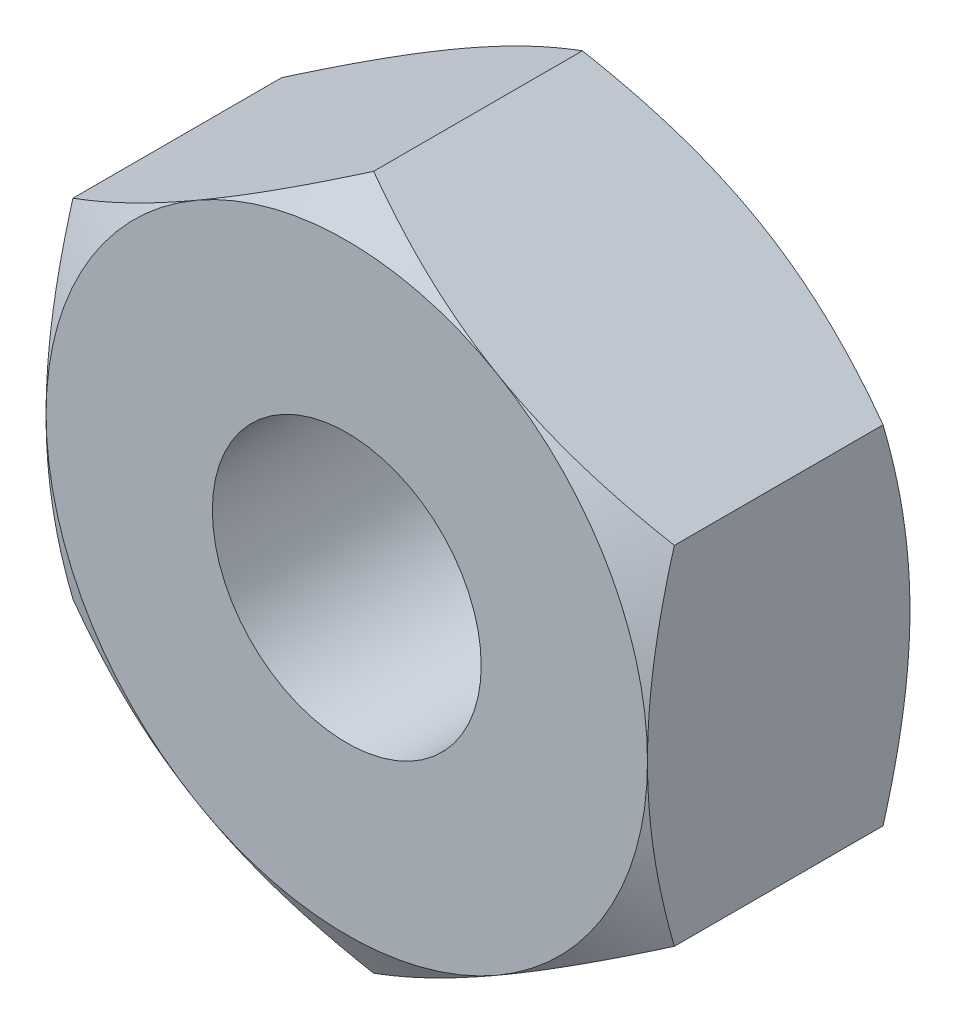
from build123d import *

# Parameters (mm, degrees)
SKETCH_1_R          = 1.229375
EXTRUDE_597_DEPTH   = 2.4
SKETCH_2_OUTSIDE_W  = 29.47
SKETCH_2_OUTSIDE_H  = 30.32
SKETCH_2_OUTSIDE_R  = 2.75
CUT_EXTRUDE_1_DEPTH = 5.837957558
CUT_EXTRUDE_1_DRAFT = -60
SKETCH_3_OUTSIDE_W  = 29.47
SKETCH_3_OUTSIDE_H  = 30.32
SKETCH_3_OUTSIDE_R  = 2.75
CUT_EXTRUDE_2_DEPTH = 5.837957558
CUT_EXTRUDE_2_DRAFT = -60


with BuildPart() as part:
    # 草图1 → Extrude 597 (new body)
    with BuildSketch(Plane.XY):
        Polygon((0, 3.175426481), (-2.75, 1.58771324), (-2.75, -1.58771324), (0, -3.175426481), (2.75, -1.58771324), (2.75, 1.58771324), align=None)
        Circle(SKETCH_1_R, mode=Mode.SUBTRACT)
    extrude(amount=EXTRUDE_597_DEPTH)


with BuildPart() as cut_extrude_1_tool:
    # 草图2 outside → 切除-拉伸1 (with draft: the straight prism first)
    with BuildSketch(Plane(origin=(0, 0, 0), x_dir=(-1, 0, 0), z_dir=(0, 0, -1))):
        Rectangle(SKETCH_2_OUTSIDE_W, SKETCH_2_OUTSIDE_H)
        Circle(SKETCH_2_OUTSIDE_R, mode=Mode.SUBTRACT)
    extrude(amount=-CUT_EXTRUDE_1_DEPTH)
    # 切除-拉伸1: the draft: its side faces are tilted about the plane it starts from
    cut_extrude_1_sides = [cut_extrude_1_tool.faces().sort_by_distance(p)[0] for p in [
        (0, -15.16, 2.918978779),
        (-14.735, 0, 2.918978779),
        (0, 15.16, 2.918978779),
        (14.735, 0, 2.918978779),
        (2.75, 0, 2.918978779),
    ]]
    draft(cut_extrude_1_sides, Plane(origin=(0, 0, 0), x_dir=(-1, 0, 0), z_dir=(0, 0, -1)), CUT_EXTRUDE_1_DRAFT)


with BuildPart() as part_1:
    add(part.part)

    # 切除-拉伸1: cut by cut_extrude_1_tool
    add(cut_extrude_1_tool.part, mode=Mode.SUBTRACT)


with BuildPart() as cut_extrude_2_tool:
    # 草图3 outside → 切除-拉伸2 (with draft: the straight prism first)
    with BuildSketch(Plane.XY.offset(2.4)):
        Rectangle(SKETCH_3_OUTSIDE_W, SKETCH_3_OUTSIDE_H)
        Circle(SKETCH_3_OUTSIDE_R, mode=Mode.SUBTRACT)
    extrude(amount=-CUT_EXTRUDE_2_DEPTH)
    # 切除-拉伸2: the draft: its side faces are tilted about the plane it starts from
    cut_extrude_2_sides = [cut_extrude_2_tool.faces().sort_by_distance(p)[0] for p in [
        (0, -15.16, -0.518978779),
        (14.735, 0, -0.518978779),
        (0, 15.16, -0.518978779),
        (-14.735, 0, -0.518978779),
        (-2.75, 0, -0.518978779),
    ]]
    draft(cut_extrude_2_sides, Plane.XY.offset(2.4), CUT_EXTRUDE_2_DRAFT)


with BuildPart() as part_2:
    add(part_1.part)

    # 切除-拉伸2: cut by cut_extrude_2_tool
    add(cut_extrude_2_tool.part, mode=Mode.SUBTRACT)


solid = part_2.part
